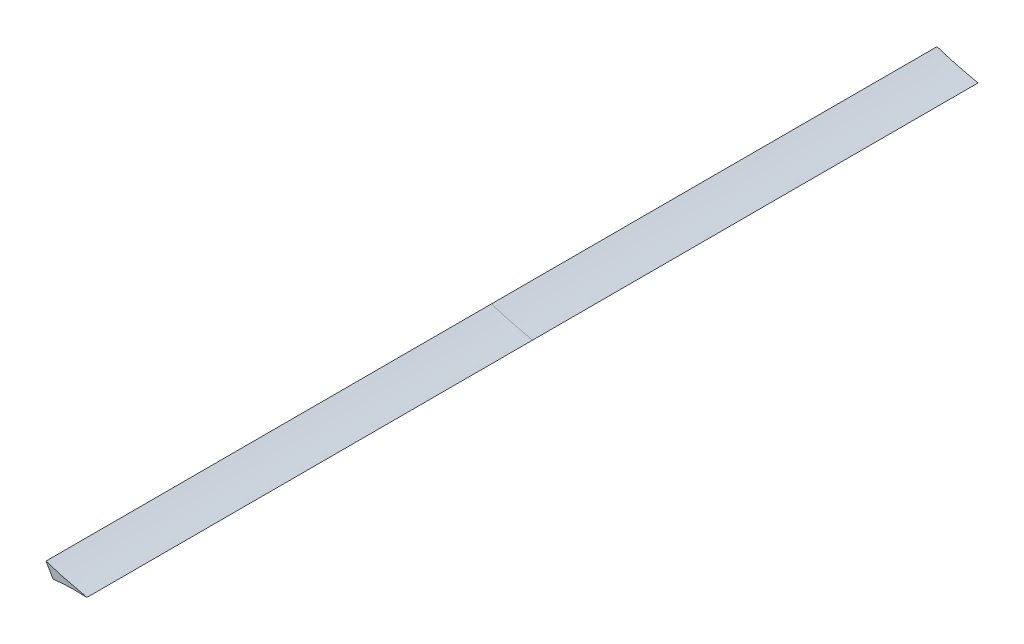
from build123d import *

# Parameters (mm, degrees)
BOSS_EXTRUDE1_DEPTH      = 450
CUT_EXTRUDE1_DEPTH       = 450
SPLIT1_SURFACE_1_1_BACK  = 451.517
SPLIT1_SURFACE_1_1_DEPTH = 903.034
SPLIT1_SURFACE_1_2_BACK  = 451.517
SPLIT1_SURFACE_1_2_DEPTH = 903.034


with BuildPart() as part:
    # Sketch1 → Boss-Extrude1 (new body)
    with BuildSketch(Plane.XY):
        with BuildLine():
            Line((0, 0), (0, 6.455757048))
            add(Edge.make_bspline(
                [(0, 0), (0.143412686, 0.016484913), (1.155999606, 0.132169735), (2.201631524, 0.245208218), (3.896423442, 0.417340987), (4.750287272, 0.498881267), (6.314615323, 0.638348706), (7.113476809, 0.704735469), (9.232431261, 0.859157936), (10.62470637, 0.935019609), (13.122922437, 1.028168621), (14.277259886, 1.054990278), (16.229032686, 1.069536531), (17.067939909, 1.065161974), (18.574822862, 1.017214036), (19.223251594, 0.986329803), (19.964717833, 0.960926399), (20.179642653, 0.955940475), (20.655932981, 0.92249765), (20.768300614, 0.914396095), (20.656916837, 0.938116524), (20.171659674, 1.043493999), (19.96296632, 1.107301445), (19.230103071, 1.299916182), (18.579400137, 1.436895191), (17.064716888, 1.76430762), (16.232418732, 1.952310911), (14.277849346, 2.403561067), (13.131919301, 2.675299468), (10.623538649, 3.290811793), (9.246450566, 3.642833408), (7.117123921, 4.223967699), (6.339303232, 4.443882416), (4.749874534, 4.912909254), (3.05098287, 5.43724377), (1.19982174, 6.047720556), (0.168184003, 6.398345237), (0, 6.455757048)],
                knots=[0.902429258, 0.902429258, 0.902429258, 0.902429258, 0.904464746, 0.916799997, 0.917258638, 0.928486821, 0.928896231, 0.939398013, 0.939782452, 0.95887652, 0.95912014, 0.974883076, 0.974987281, 0.987050365, 0.987125024, 0.995254458, 0.995335096, 0.999480576, 0.999487807, 1, 1.000527957, 1.000535122, 1.004806692, 1.004875948, 1.013224394, 1.013264825, 1.025672529, 1.025696072, 1.041990107, 1.04209876, 1.061953414, 1.062100552, 1.073248281, 1.073343314, 1.085461993, 1.098320365, 1.100826314, 1.100826314, 1.100826314, 1.100826314], degree=3))
        make_face()
    extrude(amount=BOSS_EXTRUDE1_DEPTH)

    # Sketch8 → Cut-Extrude1 (cut)
    with BuildSketch(Plane(origin=(0, 0, 0), x_dir=(-1, 0, 0), z_dir=(0, 0, -1))):
        Polygon((0, 6.455757048), (-3.509238316, 0.377577989), (0, 0), align=None)
    extrude(amount=-CUT_EXTRUDE1_DEPTH, mode=Mode.SUBTRACT)


with BuildPart() as body_2:
    # Split1: the piece behind the surface
    add(part.part)
    # Split1 surface 1: a surface, the sketch's curves swept straight by 903.034 mm
    with BuildLine(Plane(origin=(0, 0, 0), x_dir=(1, 0, 0), z_dir=(0, 1, 0)).offset(-SPLIT1_SURFACE_1_1_BACK), mode=Mode.PRIVATE) as split1_surface_1_1_path:
        Line((0, -225), (20.712743012, -225))
    split1_surface_1_1 = Shell.extrude(split1_surface_1_1_path.wire(), (0 * SPLIT1_SURFACE_1_1_DEPTH, 1 * SPLIT1_SURFACE_1_1_DEPTH, 0 * SPLIT1_SURFACE_1_1_DEPTH))
    split(bisect_by=split1_surface_1_1, keep=Keep.BOTTOM)


with BuildPart() as part_1:
    add(part.part)

    # Split1: split by a surface, the side it looks to stays
    # Split1 surface 1: a surface, the sketch's curves swept straight by 903.034 mm
    with BuildLine(Plane(origin=(0, 0, 0), x_dir=(1, 0, 0), z_dir=(0, 1, 0)).offset(-SPLIT1_SURFACE_1_2_BACK), mode=Mode.PRIVATE) as split1_surface_1_2_path:
        Line((0, -225), (20.712743012, -225))
    split1_surface_1_2 = Shell.extrude(split1_surface_1_2_path.wire(), (0 * SPLIT1_SURFACE_1_2_DEPTH, 1 * SPLIT1_SURFACE_1_2_DEPTH, 0 * SPLIT1_SURFACE_1_2_DEPTH))
    split(bisect_by=split1_surface_1_2, keep=Keep.TOP)


solid = Compound([body_2.part, part_1.part])
